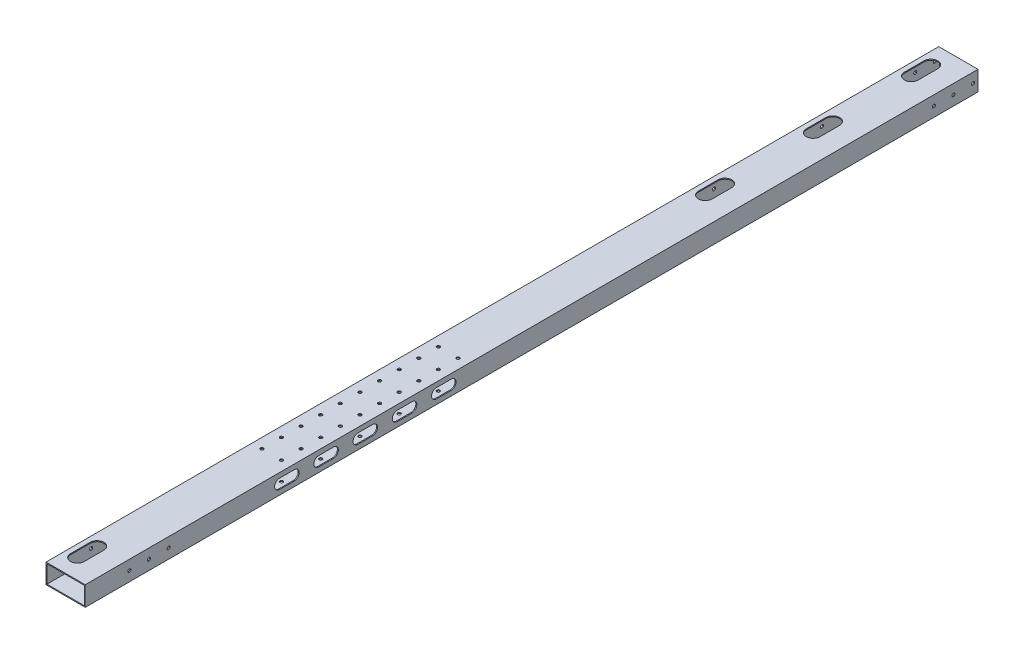
from build123d import *

# Parameters (mm, degrees)
SKETCH_1_W          = 40
SKETCH_1_H          = 20
SKETCH_1_W_2        = 38
SKETCH_1_H_2        = 18
EXTRUDE_1_DEPTH     = 910
SKETCH_2_R          = 1.6
CUT_EXTRUDE_1_DEPTH = 70
SKETCH_3_R          = 1.6
CUT_EXTRUDE_2_DEPTH = 10
CUT_EXTRUDE_4_DEPTH = 10
SKETCH_6_R          = 1.6
CUT_EXTRUDE_5_DEPTH = 912.098238391
CUT_EXTRUDE_6_REACH = 913.098


with BuildPart() as part:
    # 草图1 → 拉伸-薄壁1 (new body)
    with BuildSketch(Plane.XY):
        with Locations((-20, 10)):
            Rectangle(SKETCH_1_W, SKETCH_1_H)
        with Locations((-20, 10)):
            Rectangle(SKETCH_1_W_2, SKETCH_1_H_2, mode=Mode.SUBTRACT)
    extrude(amount=EXTRUDE_1_DEPTH)

    # 草图2 → 切除-拉伸1 (cut)
    with BuildSketch(Plane.ZY.offset(40)):
        with Locations(Location((865, 10, 0), (0, 0, 270))):
            Circle(SKETCH_2_R)
        with Locations(Location((845, 10, 0), (0, 0, 270))):
            Circle(SKETCH_2_R)
        with Locations(Location((825, 10, 0), (0, 0, 270))):
            Circle(SKETCH_2_R)
        with Locations(Location((45, 10, 0), (0, 0, 270))):
            Circle(SKETCH_2_R)
        with Locations(Location((25, 10, 0), (0, 0, 270))):
            Circle(SKETCH_2_R)
        with Locations(Location((5, 10, 0), (0, 0, 270))):
            Circle(SKETCH_2_R)
    extrude(amount=-CUT_EXTRUDE_1_DEPTH, mode=Mode.SUBTRACT)

    # 草图3 → 切除-拉伸2 (cut)
    with BuildSketch(Plane.ZY.offset(40)):
        with Locations(Location((120, 10, 0), (0, 0, 270))):
            Circle(SKETCH_3_R)
        with Locations(Location((140, 10, 0), (0, 0, 270))):
            Circle(SKETCH_3_R)
        with Locations(Location((230, 10, 0), (0, 0, 270))):
            Circle(SKETCH_3_R)
        with Locations(Location((250, 10, 0), (0, 0, 270))):
            Circle(SKETCH_3_R)
    extrude(amount=-CUT_EXTRUDE_2_DEPTH, mode=Mode.SUBTRACT)

    # 草图5 → 切除-拉伸4 (cut)
    with BuildSketch(Plane(origin=(0, 20, 0), x_dir=(1, 0, 0), z_dir=(0, 1, 0))):
        with BuildLine():
            Line((-21, -120), (-21, -140))
            ThreePointArc((-21, -140), (-28, -147), (-35, -140))
            Line((-35, -140), (-35, -120))
            ThreePointArc((-35, -120), (-28, -113), (-21, -120))
        make_face()
        with BuildLine():
            Line((-21, -230), (-21, -250))
            ThreePointArc((-21, -250), (-28, -257), (-35, -250))
            Line((-35, -250), (-35, -230))
            ThreePointArc((-35, -230), (-28, -223), (-21, -230))
        make_face()
        with BuildLine():
            Line((-21, -20), (-21, -40))
            ThreePointArc((-21, -40), (-28, -47), (-35, -40))
            Line((-35, -40), (-35, -20))
            ThreePointArc((-35, -20), (-28, -13), (-21, -20))
        make_face()
        with BuildLine():
            Line((-21, -870), (-21, -890))
            ThreePointArc((-21, -890), (-28, -897), (-35, -890))
            Line((-35, -890), (-35, -870))
            ThreePointArc((-35, -870), (-28, -863), (-21, -870))
        make_face()
    extrude(amount=-CUT_EXTRUDE_4_DEPTH, mode=Mode.SUBTRACT)

    # 草图6 → 切除-拉伸5 (cut, through all)
    with BuildSketch(Plane(origin=(0, 20, 0), x_dir=(1, 0, 0), z_dir=(0, 1, 0))):
        with Locations(Location((-30, -700, 0), (0, 0, 270))):
            Circle(SKETCH_6_R)
        with Locations(Location((-10, -700, 0), (0, 0, 270))):
            Circle(SKETCH_6_R)
        with Locations(Location((-10, -680, 0), (0, 0, 270))):
            Circle(SKETCH_6_R)
        with Locations(Location((-10, -660, 0), (0, 0, 270))):
            Circle(SKETCH_6_R)
        with Locations(Location((-10, -640, 0), (0, 0, 270))):
            Circle(SKETCH_6_R)
        with Locations(Location((-10, -620, 0), (0, 0, 270))):
            Circle(SKETCH_6_R)
        with Locations(Location((-10, -600, 0), (0, 0, 270))):
            Circle(SKETCH_6_R)
        with Locations(Location((-10, -580, 0), (0, 0, 270))):
            Circle(SKETCH_6_R)
        with Locations(Location((-10, -560, 0), (0, 0, 270))):
            Circle(SKETCH_6_R)
        with Locations(Location((-10, -540, 0), (0, 0, 270))):
            Circle(SKETCH_6_R)
        with Locations(Location((-10, -520, 0), (0, 0, 270))):
            Circle(SKETCH_6_R)
        with Locations(Location((-30, -680, 0), (0, 0, 270))):
            Circle(SKETCH_6_R)
        with Locations(Location((-30, -660, 0), (0, 0, 270))):
            Circle(SKETCH_6_R)
        with Locations(Location((-30, -640, 0), (0, 0, 270))):
            Circle(SKETCH_6_R)
        with Locations(Location((-30, -620, 0), (0, 0, 270))):
            Circle(SKETCH_6_R)
        with Locations(Location((-30, -600, 0), (0, 0, 270))):
            Circle(SKETCH_6_R)
        with Locations(Location((-30, -580, 0), (0, 0, 270))):
            Circle(SKETCH_6_R)
        with Locations(Location((-30, -560, 0), (0, 0, 270))):
            Circle(SKETCH_6_R)
        with Locations(Location((-30, -540, 0), (0, 0, 270))):
            Circle(SKETCH_6_R)
        with Locations(Location((-30, -520, 0), (0, 0, 270))):
            Circle(SKETCH_6_R)
    extrude(amount=-CUT_EXTRUDE_5_DEPTH, mode=Mode.SUBTRACT)

    # 草图7 → 切除-拉伸6 (cut, up to next)
    with BuildSketch(Plane(origin=(0, 0, 0), x_dir=(0, 0, -1), z_dir=(1, 0, 0)), mode=Mode.PRIVATE) as cut_extrude_6_sk1:
        with BuildLine():
            Line((-712, 15), (-697, 15))
            ThreePointArc((-697, 15), (-692, 10), (-697, 5))
            Line((-697, 5), (-712, 5))
            ThreePointArc((-712, 5), (-717, 10), (-712, 15))
        make_face()
    cut_extrude_6_tool1 = extrude(cut_extrude_6_sk1.sketch, amount=-CUT_EXTRUDE_6_REACH, mode=Mode.PRIVATE) & part.part
    # 草图7 → 切除-拉伸6 (cut, up to next)
    with BuildSketch(Plane(origin=(0, 0, 0), x_dir=(0, 0, -1), z_dir=(1, 0, 0)), mode=Mode.PRIVATE) as cut_extrude_6_sk2:
        with BuildLine():
            Line((-672, 15), (-657, 15))
            ThreePointArc((-657, 15), (-652, 10), (-657, 5))
            Line((-657, 5), (-672, 5))
            ThreePointArc((-672, 5), (-677, 10), (-672, 15))
        make_face()
    cut_extrude_6_tool2 = extrude(cut_extrude_6_sk2.sketch, amount=-CUT_EXTRUDE_6_REACH, mode=Mode.PRIVATE) & part.part
    # 草图7 → 切除-拉伸6 (cut, up to next)
    with BuildSketch(Plane(origin=(0, 0, 0), x_dir=(0, 0, -1), z_dir=(1, 0, 0)), mode=Mode.PRIVATE) as cut_extrude_6_sk3:
        with BuildLine():
            Line((-632, 15), (-617, 15))
            ThreePointArc((-617, 15), (-612, 10), (-617, 5))
            Line((-617, 5), (-632, 5))
            ThreePointArc((-632, 5), (-637, 10), (-632, 15))
        make_face()
    cut_extrude_6_tool3 = extrude(cut_extrude_6_sk3.sketch, amount=-CUT_EXTRUDE_6_REACH, mode=Mode.PRIVATE) & part.part
    # 草图7 → 切除-拉伸6 (cut, up to next)
    with BuildSketch(Plane(origin=(0, 0, 0), x_dir=(0, 0, -1), z_dir=(1, 0, 0)), mode=Mode.PRIVATE) as cut_extrude_6_sk4:
        with BuildLine():
            Line((-592, 15), (-577, 15))
            ThreePointArc((-577, 15), (-572, 10), (-577, 5))
            Line((-577, 5), (-592, 5))
            ThreePointArc((-592, 5), (-597, 10), (-592, 15))
        make_face()
    cut_extrude_6_tool4 = extrude(cut_extrude_6_sk4.sketch, amount=-CUT_EXTRUDE_6_REACH, mode=Mode.PRIVATE) & part.part
    # 草图7 → 切除-拉伸6 (cut, up to next)
    with BuildSketch(Plane(origin=(0, 0, 0), x_dir=(0, 0, -1), z_dir=(1, 0, 0)), mode=Mode.PRIVATE) as cut_extrude_6_sk5:
        with BuildLine():
            Line((-552, 15), (-537, 15))
            ThreePointArc((-537, 15), (-532, 10), (-537, 5))
            Line((-537, 5), (-552, 5))
            ThreePointArc((-552, 5), (-557, 10), (-552, 15))
        make_face()
    cut_extrude_6_tool5 = extrude(cut_extrude_6_sk5.sketch, amount=-CUT_EXTRUDE_6_REACH, mode=Mode.PRIVATE) & part.part
    add(cut_extrude_6_tool1.solids().sort_by_distance((0, 10, 704.5))[0], mode=Mode.SUBTRACT)
    add(cut_extrude_6_tool2.solids().sort_by_distance((0, 10, 664.5))[0], mode=Mode.SUBTRACT)
    add(cut_extrude_6_tool3.solids().sort_by_distance((0, 10, 624.5))[0], mode=Mode.SUBTRACT)
    add(cut_extrude_6_tool4.solids().sort_by_distance((0, 10, 584.5))[0], mode=Mode.SUBTRACT)
    add(cut_extrude_6_tool5.solids().sort_by_distance((0, 10, 544.5))[0], mode=Mode.SUBTRACT)


solid = part.part
